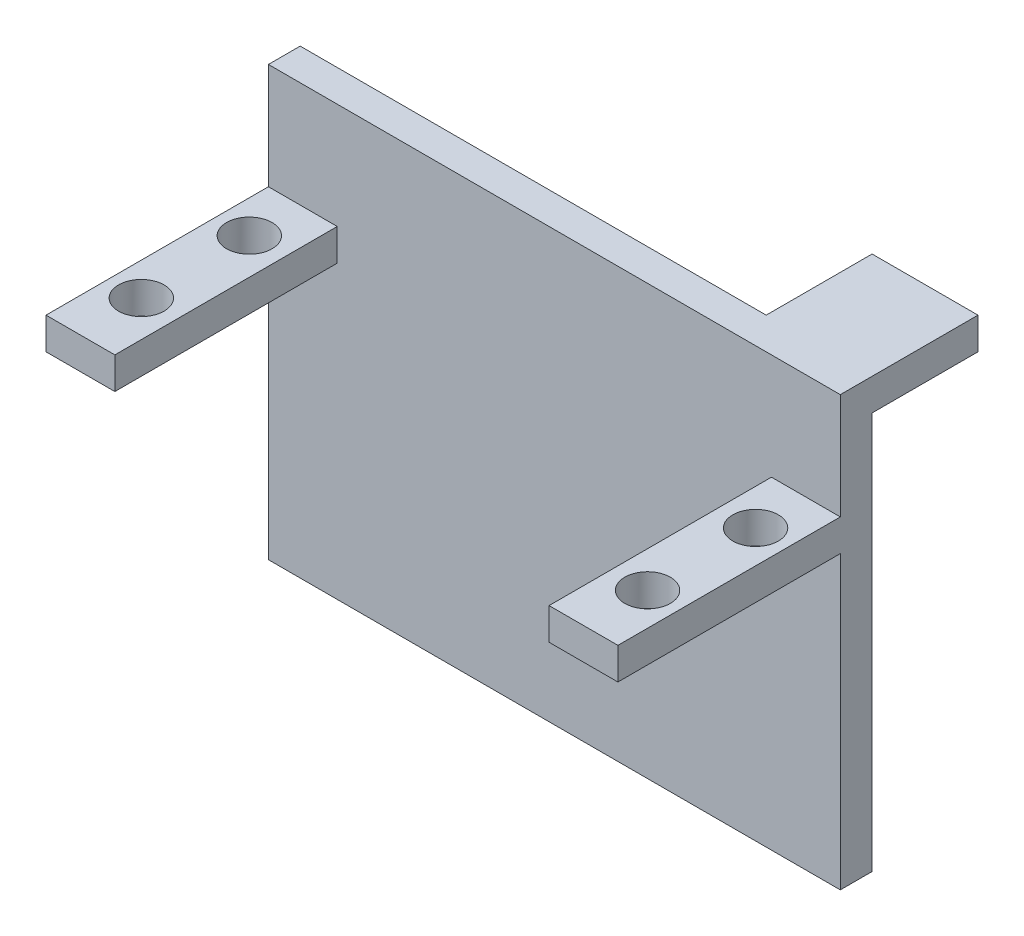
from build123d import *

# Parameters (mm, degrees)
SKETCH1_W           = 54
SKETCH1_H           = 40.5
BOSS_EXTRUDE1_DEPTH = 3
SKETCH3_W           = 6.5
SKETCH3_H           = 3
BOSS_EXTRUDE2_DEPTH = 21
SKETCH4_W           = 10
SKETCH4_H           = 3
BOSS_EXTRUDE3_DEPTH = 10
SKETCH5_R           = 2.15
CUT_EXTRUDE1_DEPTH  = 3


with BuildPart() as part:
    # Sketch1 → Boss-Extrude1 (new body)
    with BuildSketch(Plane.XY):
        with Locations((7.441119081, -3.357474474)):
            Rectangle(SKETCH1_W, SKETCH1_H)
    extrude(amount=BOSS_EXTRUDE1_DEPTH)

    # Sketch3 → Boss-Extrude2 (add)
    with BuildSketch(Plane.XY.offset(3)):
        with Locations((31.191119081, 5.392525526)):
            Rectangle(SKETCH3_W, SKETCH3_H)
        with Locations((-16.308880919, 5.392525526)):
            Rectangle(SKETCH3_W, SKETCH3_H)
    extrude(amount=BOSS_EXTRUDE2_DEPTH)

    # Sketch4 → Boss-Extrude3 (add)
    with BuildSketch(Plane(origin=(0, 0, 0), x_dir=(-1, 0, 0), z_dir=(0, 0, -1))):
        with Locations((-29.441119081, 15.392525526)):
            Rectangle(SKETCH4_W, SKETCH4_H)
    extrude(amount=BOSS_EXTRUDE3_DEPTH)

    # Sketch5 → Cut-Extrude1 (cut)
    with BuildSketch(Plane(origin=(0, 6.892525526, 0), x_dir=(1, 0, 0), z_dir=(0, 1, 0))):
        with Locations(Location((31.341119081, -18.1, 0), (0, 0, 270))):
            Circle(SKETCH5_R)
        with Locations(Location((31.341119081, -7.9, 0), (0, 0, 270))):
            Circle(SKETCH5_R)
        with Locations(Location((-16.458880919, -18.1, 0), (0, 0, 270))):
            Circle(SKETCH5_R)
        with Locations(Location((-16.458880919, -7.9, 0), (0, 0, 270))):
            Circle(SKETCH5_R)
    extrude(amount=-CUT_EXTRUDE1_DEPTH, mode=Mode.SUBTRACT)


solid = part.part
